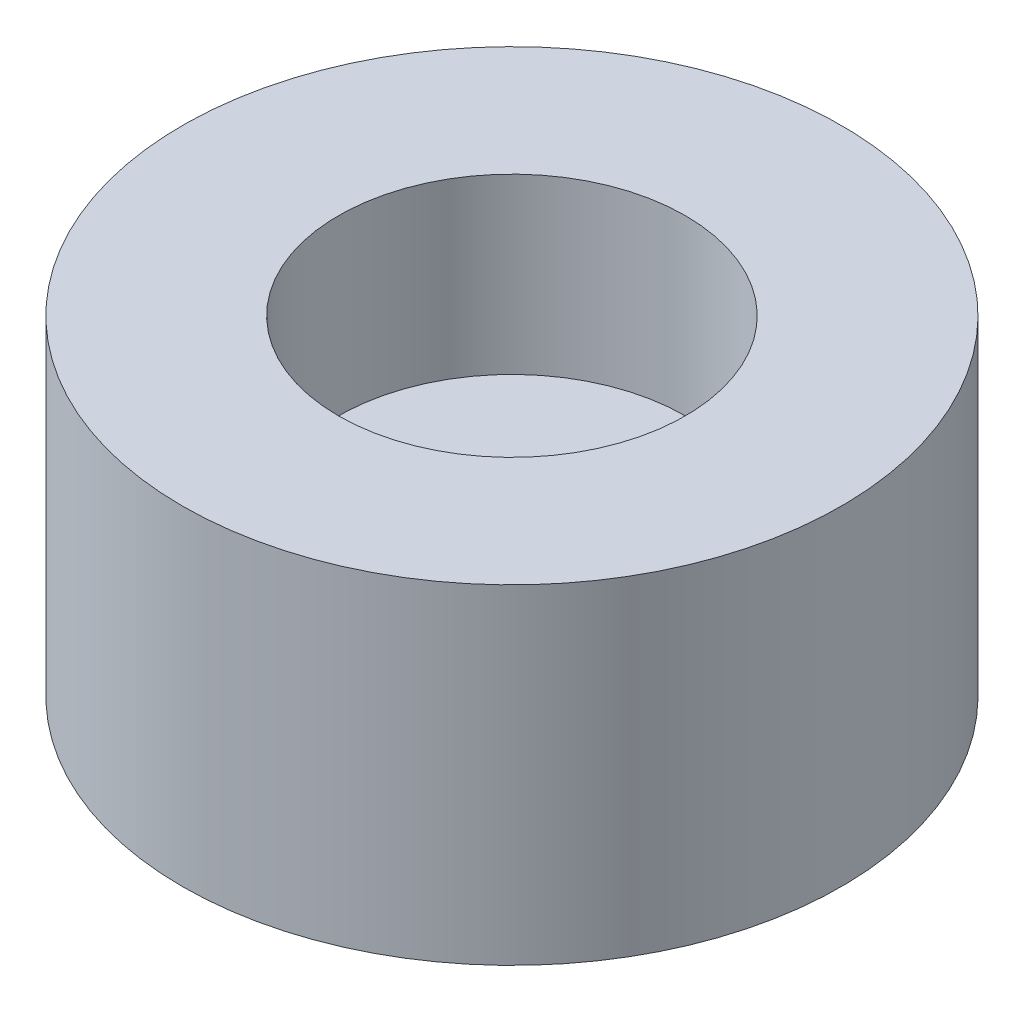
from build123d import *

# Parameters (mm, degrees)
SKETCH1_R           = 19
BOSS_EXTRUDE1_DEPTH = 19
SKETCH2_R           = 10
CUT_EXTRUDE1_DEPTH  = 10
SKETCH3_R           = 3.5
CUT_EXTRUDE2_DEPTH  = 9


with BuildPart() as part:
    # Sketch1 → Boss-Extrude1 (new body)
    with BuildSketch(Plane(origin=(0, 0, 0), x_dir=(1, 0, 0), z_dir=(0, 1, 0))):
        with Locations(Location((0, 0, 0), (0, 0, 270))):
            Circle(SKETCH1_R)
    extrude(amount=BOSS_EXTRUDE1_DEPTH)

    # Sketch2 → Cut-Extrude1 (cut)
    with BuildSketch(Plane(origin=(0, 19, 0), x_dir=(1, 0, 0), z_dir=(0, 1, 0))):
        with Locations(Location((0, 0, 0), (0, 0, 270))):
            Circle(SKETCH2_R)
    extrude(amount=-CUT_EXTRUDE1_DEPTH, mode=Mode.SUBTRACT)

    # Sketch3 → Cut-Extrude2 (cut)
    with BuildSketch(Plane(origin=(0, 9, 0), x_dir=(1, 0, 0), z_dir=(0, 1, 0))):
        with Locations(Location((0, 0, 0), (0, 0, 270))):
            Circle(SKETCH3_R)
    extrude(amount=-CUT_EXTRUDE2_DEPTH, mode=Mode.SUBTRACT)


solid = part.part
